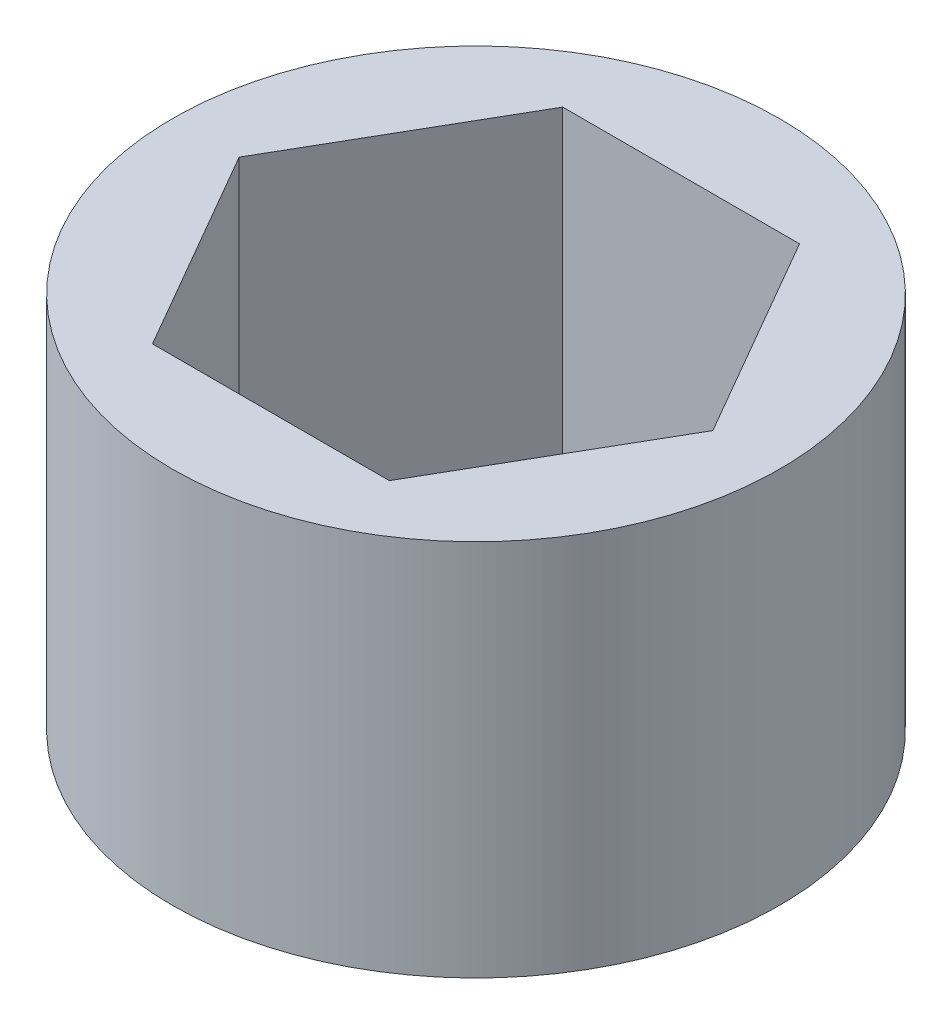
from build123d import *

# Parameters (mm, degrees)
SKETCH1_R           = 7.14375
BOSS_EXTRUDE1_DEPTH = 4.445


with BuildPart() as part:
    # Sketch1 → Boss-Extrude1 (new, symmetric)
    with BuildSketch(Plane(origin=(0, 0, 0), x_dir=(1, 0, 0), z_dir=(0, 1, 0))):
        with Locations(Location((0, 0, 0), (0, 0, 270))):
            Circle(SKETCH1_R)
        Polygon((2.786292399, -4.826), (5.572584798, 0), (2.786292399, 4.826), (-2.786292399, 4.826), (-5.572584798, 0), (-2.786292399, -4.826), align=None, mode=Mode.SUBTRACT)
    extrude(amount=BOSS_EXTRUDE1_DEPTH, both=True)


solid = part.part
